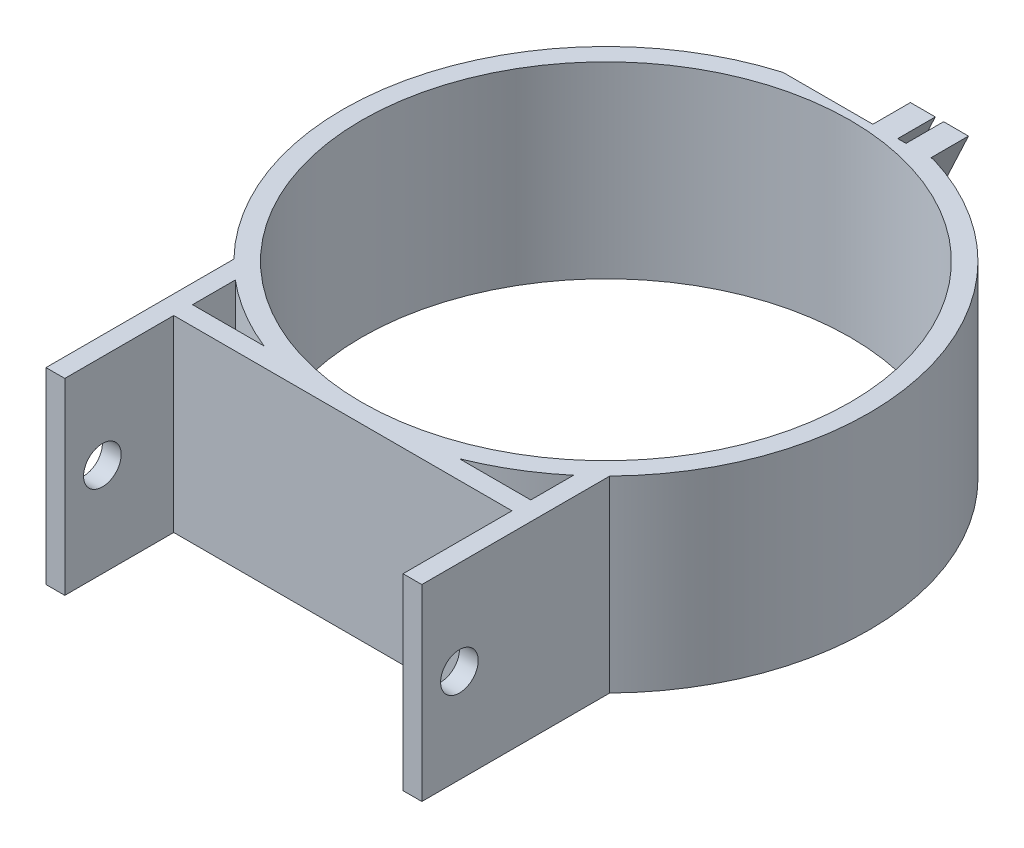
from build123d import *

# Parameters (mm, degrees)
SKETCH1_R               = 32.5
BOSS_EXTRUDE1_DEPTH     = 25
CUT_EXTRUDE1_DEPTH      = 5
CUT_EXTRUDE2_DEPTH      = 82.699111815
CUT_EXTRUDE2_DEPTH_BACK = 82.699111815
SKETCH3_R               = 2.5


with BuildPart() as part:
    # Sketch1 → Boss-Extrude1 (new body)
    with BuildSketch(Plane(origin=(0, 0, 0), x_dir=(1, 0, 0), z_dir=(0, 1, 0))):
        with BuildLine():
            Line((-22.5, -35), (22.5, -35))
            Line((22.5, -35), (22.5, -49.494897428))
            Line((22.5, -49.494897428), (25, -49.494897428))
            Line((25, -49.494897428), (25, -35))
            Line((25, -35), (25, -24.494897428))
            ThreePointArc((25, -24.494897428), (33.886456264, 8.758315013), (10, 33.541019662))
            Line((10, 33.541019662), (10, 38.541019662))
            Line((10, 38.541019662), (-10, 38.541019662))
            Line((-10, 38.541019662), (-10, 33.541019662))
            ThreePointArc((-10, 33.541019662), (-33.886456264, 8.758315013), (-25, -24.494897428))
            Line((-25, -24.494897428), (-25, -35))
            Line((-25, -35), (-25, -49.494897428))
            Line((-25, -49.494897428), (-22.5, -49.494897428))
            Line((-22.5, -49.494897428), (-22.5, -35))
        make_face()
        Circle(SKETCH1_R, mode=Mode.SUBTRACT)
        with BuildLine():
            Line((-22.5, -26.809513237), (-22.5, -32.5))
            Line((-22.5, -32.5), (-12.990381057, -32.5))
            ThreePointArc((-12.990381057, -32.5), (-17.971844557, -30.033527985), (-22.5, -26.809513237))
        make_face(mode=Mode.SUBTRACT)
        with BuildLine():
            Line((22.5, -32.5), (22.5, -26.809513237))
            ThreePointArc((22.5, -26.809513237), (17.971844557, -30.033527985), (12.990381057, -32.5))
            Line((12.990381057, -32.5), (22.5, -32.5))
        make_face(mode=Mode.SUBTRACT)
    extrude(amount=BOSS_EXTRUDE1_DEPTH)

    # Sketch2 → Cut-Extrude1 (cut)
    with BuildSketch(Plane(origin=(0, 0, -38.541019662), x_dir=(-1, 0, 0), z_dir=(0, 0, -1))):
        Polygon((-6.380534686, 25), (5.277156767, 0), (6.380534686, 0), (-5.277156767, 25), align=None)
        Polygon((-1.967023011, 25), (10, 25), (10, 0), (9.690668443, 0), align=None)
        Polygon((-9.690668443, 25), (-10, 25), (-10, -0.029833576), (1.967023011, 0), align=None)
    extrude(amount=-CUT_EXTRUDE1_DEPTH, mode=Mode.SUBTRACT)

    # Sketch3 → Cut-Extrude2 (cut, two sides: drawn at the far end of the back side and taken through both)
    with BuildSketch(Plane(origin=(25, 0, 0), x_dir=(0, 0, -1), z_dir=(1, 0, 0)).offset(-CUT_EXTRUDE2_DEPTH_BACK)):
        with Locations((-44.494897428, 12.5)):
            Circle(SKETCH3_R)
    extrude(amount=CUT_EXTRUDE2_DEPTH + CUT_EXTRUDE2_DEPTH_BACK, mode=Mode.SUBTRACT)


solid = part.part
